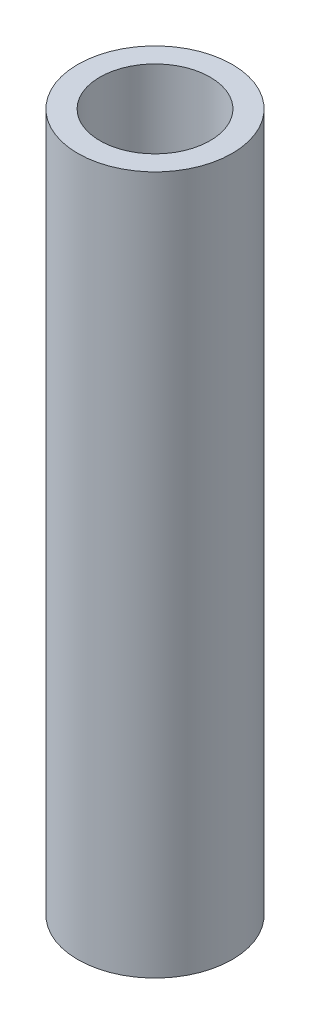
from build123d import *

# Parameters (mm, degrees)
SKETCH1_R           = 13.335
SKETCH1_R_2         = 9.525
BOSS_EXTRUDE1_DEPTH = 120.65


with BuildPart() as part:
    # Sketch1 → Boss-Extrude1 (new body)
    with BuildSketch(Plane(origin=(0, 0, 0), x_dir=(1, 0, 0), z_dir=(0, 1, 0))):
        with Locations(Location((0, 0, 0), (0, 0, 90))):
            Circle(SKETCH1_R)
        with Locations(Location((0, 0, 0), (0, 0, 90))):
            Circle(SKETCH1_R_2, mode=Mode.SUBTRACT)
    extrude(amount=BOSS_EXTRUDE1_DEPTH)


solid = part.part
